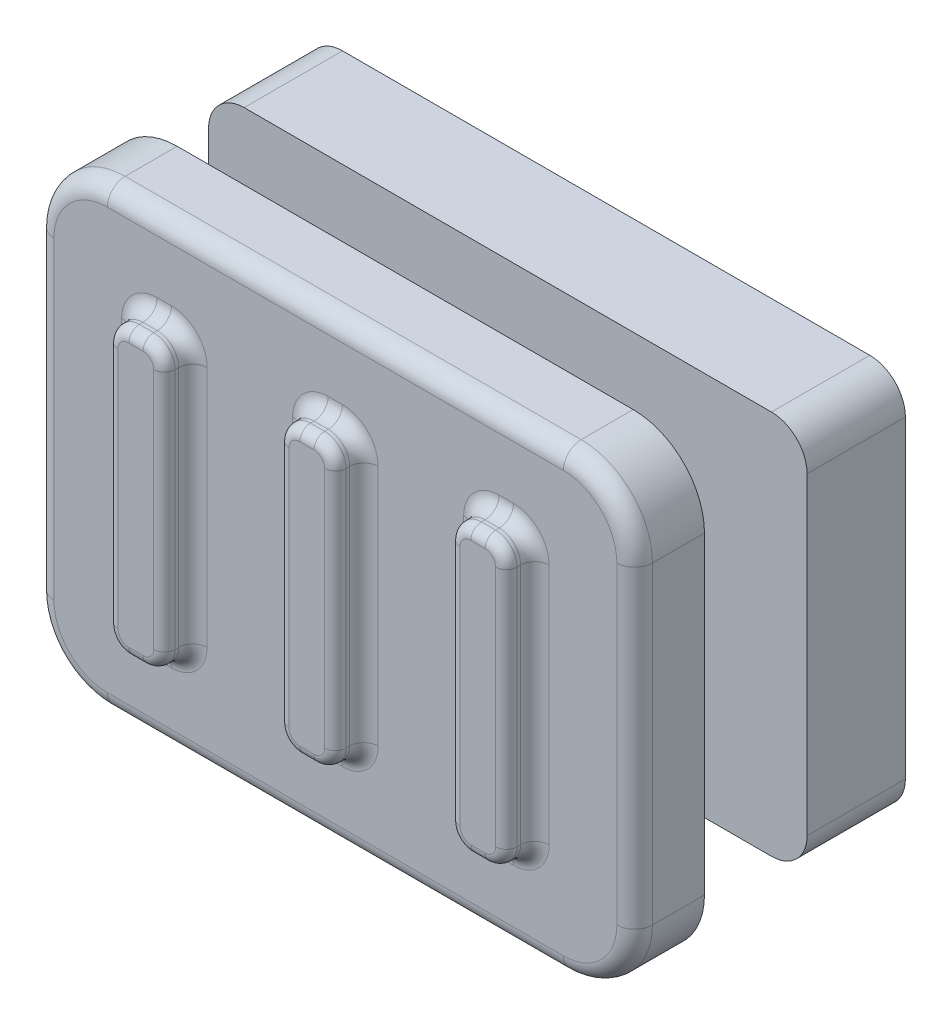
from build123d import *

# Parameters (mm, degrees)
SLIDER_STEM_DEPTH         = 4.2
CAPTIVE_FLANGE_START      = 1.2
CAPTIVE_FLANGE_DEPTH      = 1.38
THUMB_PAD_START           = 4.02
THUMB_PAD_DEPTH           = 0.98
SWITCH_PIN_SOCKET_START   = 2.3
SWITCH_PIN_SOCKET_DEPTH   = 2.4
PCB_EDGE_RELIEF_START     = 0.6
PCB_EDGE_RELIEF_PROFILE_W = 4
PCB_EDGE_RELIEF_PROFILE_H = 1.05
PCB_EDGE_RELIEF_DEPTH     = 0.7
STEM_SHOULDER_ROUND_R     = 0.2
THUMB_RIB_0_START         = 4.9
THUMB_RIB_0_DEPTH         = 0.5
THUMB_RIB_1_START         = 4.9
THUMB_RIB_1_DEPTH         = 0.5
THUMB_RIB_2_START         = 4.9
THUMB_RIB_2_DEPTH         = 0.5
THUMB_RIB_ROOT_ROUND_R    = 0.2
THUMB_PAD_EDGE_ROUND_R    = 0.25
THUMB_RIB_CROWN_ROUND_R   = 0.15


with BuildPart() as part:
    # Slider_stem_profile → Slider_stem (new body)
    with BuildSketch(Plane.XY):
        with BuildLine():
            Line((-1.5, -1.5), (1.5, -1.5))
            ThreePointArc((1.5, -1.5), (1.782842712, -1.382842712), (1.9, -1.1))
            Line((1.9, -1.1), (1.9, 1.1))
            ThreePointArc((1.9, 1.1), (1.782842712, 1.382842712), (1.5, 1.5))
            Line((1.5, 1.5), (-1.5, 1.5))
            ThreePointArc((-1.5, 1.5), (-1.782842712, 1.382842712), (-1.9, 1.1))
            Line((-1.9, 1.1), (-1.9, -1.1))
            ThreePointArc((-1.9, -1.1), (-1.782842712, -1.382842712), (-1.5, -1.5))
        make_face()
    extrude(amount=SLIDER_STEM_DEPTH)

    # Captive_flange_profile → Captive_flange (add)
    with BuildSketch(Plane.XY.offset(CAPTIVE_FLANGE_START)):
        with BuildLine():
            Line((-3.7, -2.7), (3.7, -2.7))
            ThreePointArc((3.7, -2.7), (4.053553391, -2.553553391), (4.2, -2.2))
            Line((4.2, -2.2), (4.2, 2.2))
            ThreePointArc((4.2, 2.2), (4.053553391, 2.553553391), (3.7, 2.7))
            Line((3.7, 2.7), (-3.7, 2.7))
            ThreePointArc((-3.7, 2.7), (-4.053553391, 2.553553391), (-4.2, 2.2))
            Line((-4.2, 2.2), (-4.2, -2.2))
            ThreePointArc((-4.2, -2.2), (-4.053553391, -2.553553391), (-3.7, -2.7))
        make_face()
    extrude(amount=CAPTIVE_FLANGE_DEPTH)

    # Thumb_pad_profile → Thumb_pad (add)
    with BuildSketch(Plane.XY.offset(THUMB_PAD_START)):
        with BuildLine():
            Line((-3.2, -3.2), (3.2, -3.2))
            ThreePointArc((3.2, -3.2), (3.907106781, -2.907106781), (4.2, -2.2))
            Line((4.2, -2.2), (4.2, 2.2))
            ThreePointArc((4.2, 2.2), (3.907106781, 2.907106781), (3.2, 3.2))
            Line((3.2, 3.2), (-3.2, 3.2))
            ThreePointArc((-3.2, 3.2), (-3.907106781, 2.907106781), (-4.2, 2.2))
            Line((-4.2, 2.2), (-4.2, -2.2))
            ThreePointArc((-4.2, -2.2), (-3.907106781, -2.907106781), (-3.2, -3.2))
        make_face()
    extrude(amount=THUMB_PAD_DEPTH)

    # Switch_pin_socket_profile → Switch_pin_socket (cut)
    with BuildSketch(Plane.XY.offset(SWITCH_PIN_SOCKET_START)):
        with BuildLine():
            Line((-0.725, -0.6), (0.725, -0.6))
            ThreePointArc((0.725, -0.6), (0.795710678, -0.570710678), (0.825, -0.5))
            Line((0.825, -0.5), (0.825, 0.5))
            ThreePointArc((0.825, 0.5), (0.795710678, 0.570710678), (0.725, 0.6))
            Line((0.725, 0.6), (-0.725, 0.6))
            ThreePointArc((-0.725, 0.6), (-0.795710678, 0.570710678), (-0.825, 0.5))
            Line((-0.825, 0.5), (-0.825, -0.5))
            ThreePointArc((-0.825, -0.5), (-0.795710678, -0.570710678), (-0.725, -0.6))
        make_face()
    extrude(amount=-SWITCH_PIN_SOCKET_DEPTH, mode=Mode.SUBTRACT)

    # PCB_edge_relief_profile → PCB_edge_relief (cut)
    with BuildSketch(Plane.XY.offset(PCB_EDGE_RELIEF_START)):
        with Locations((0, 1.075)):
            Rectangle(PCB_EDGE_RELIEF_PROFILE_W, PCB_EDGE_RELIEF_PROFILE_H)
    extrude(amount=-PCB_EDGE_RELIEF_DEPTH, mode=Mode.SUBTRACT)

    # Stem_shoulder_round
    stem_shoulder_round_edges = [part.edges().sort_by_distance(p)[0] for p in [
        (-1.9, 0, 1.2),
        (-1.9, 0, 2.58),
        (-1.782842712, -1.382842712, 1.2),
        (0, -1.5, 1.2),
        (1.782842712, -1.382842712, 1.2),
        (1.9, 0, 1.2),
        (1.782842712, 1.382842712, 1.2),
        (0, 1.5, 1.2),
        (-1.782842712, 1.382842712, 1.2),
        (-1.782842712, -1.382842712, 2.58),
        (0, -1.5, 2.58),
        (1.782842712, -1.382842712, 2.58),
        (1.9, 0, 2.58),
        (1.782842712, 1.382842712, 2.58),
        (0, 1.5, 2.58),
        (-1.782842712, 1.382842712, 2.58),
        (-1.9, 0, 4.02),
        (-1.782842712, -1.382842712, 4.02),
        (0, -1.5, 4.02),
        (1.782842712, -1.382842712, 4.02),
        (1.9, 0, 4.02),
        (1.782842712, 1.382842712, 4.02),
        (0, 1.5, 4.02),
        (-1.782842712, 1.382842712, 4.02),
    ]]
    fillet(stem_shoulder_round_edges, radius=STEM_SHOULDER_ROUND_R)

    # Thumb_rib_0_profile → Thumb_rib_0 (add)
    with BuildSketch(Plane.XY.offset(THUMB_RIB_0_START)):
        with BuildLine():
            Line((-2.5, -2), (-2.3, -2))
            ThreePointArc((-2.3, -2), (-2.087867966, -1.912132034), (-2, -1.7))
            Line((-2, -1.7), (-2, 1.7))
            ThreePointArc((-2, 1.7), (-2.087867966, 1.912132034), (-2.3, 2))
            Line((-2.3, 2), (-2.5, 2))
            ThreePointArc((-2.5, 2), (-2.712132034, 1.912132034), (-2.8, 1.7))
            Line((-2.8, 1.7), (-2.8, -1.7))
            ThreePointArc((-2.8, -1.7), (-2.712132034, -1.912132034), (-2.5, -2))
        make_face()
    extrude(amount=THUMB_RIB_0_DEPTH)

    # Thumb_rib_1_profile → Thumb_rib_1 (add)
    with BuildSketch(Plane.XY.offset(THUMB_RIB_1_START)):
        with BuildLine():
            Line((-0.1, -2), (0.1, -2))
            ThreePointArc((0.1, -2), (0.312132034, -1.912132034), (0.4, -1.7))
            Line((0.4, -1.7), (0.4, 1.7))
            ThreePointArc((0.4, 1.7), (0.312132034, 1.912132034), (0.1, 2))
            Line((0.1, 2), (-0.1, 2))
            ThreePointArc((-0.1, 2), (-0.312132034, 1.912132034), (-0.4, 1.7))
            Line((-0.4, 1.7), (-0.4, -1.7))
            ThreePointArc((-0.4, -1.7), (-0.312132034, -1.912132034), (-0.1, -2))
        make_face()
    extrude(amount=THUMB_RIB_1_DEPTH)

    # Thumb_rib_2_profile → Thumb_rib_2 (add)
    with BuildSketch(Plane.XY.offset(THUMB_RIB_2_START)):
        with BuildLine():
            Line((2.3, -2), (2.5, -2))
            ThreePointArc((2.5, -2), (2.712132034, -1.912132034), (2.8, -1.7))
            Line((2.8, -1.7), (2.8, 1.7))
            ThreePointArc((2.8, 1.7), (2.712132034, 1.912132034), (2.5, 2))
            Line((2.5, 2), (2.3, 2))
            ThreePointArc((2.3, 2), (2.087867966, 1.912132034), (2, 1.7))
            Line((2, 1.7), (2, -1.7))
            ThreePointArc((2, -1.7), (2.087867966, -1.912132034), (2.3, -2))
        make_face()
    extrude(amount=THUMB_RIB_2_DEPTH)

    # Thumb_rib_root_round
    thumb_rib_root_round_edges = [part.edges().sort_by_distance(p)[0] for p in [
        (-2.8, 0, 5),
        (-2.712132034, 1.912132034, 5),
        (-2.4, 2, 5),
        (-2.087867966, 1.912132034, 5),
        (-2, 0, 5),
        (-2.087867966, -1.912132034, 5),
        (-2.4, -2, 5),
        (-2.712132034, -1.912132034, 5),
        (-0.4, 0, 5),
        (-0.312132034, 1.912132034, 5),
        (0, 2, 5),
        (0.312132034, 1.912132034, 5),
        (0.4, 0, 5),
        (0.312132034, -1.912132034, 5),
        (0, -2, 5),
        (-0.312132034, -1.912132034, 5),
        (2, 0, 5),
        (2.087867966, 1.912132034, 5),
        (2.4, 2, 5),
        (2.712132034, 1.912132034, 5),
        (2.8, 0, 5),
        (2.712132034, -1.912132034, 5),
        (2.4, -2, 5),
        (2.087867966, -1.912132034, 5),
    ]]
    fillet(thumb_rib_root_round_edges, radius=THUMB_RIB_ROOT_ROUND_R)

    # Thumb_pad_edge_round
    thumb_pad_edge_round_edges = [part.edges().sort_by_distance(p)[0] for p in [
        (-3.907106781, -2.907106781, 5),
        (0, -3.2, 5),
        (3.907106781, -2.907106781, 5),
        (4.2, 0, 5),
        (3.907106781, 2.907106781, 5),
        (0, 3.2, 5),
        (-3.907106781, 2.907106781, 5),
        (-4.2, 0, 5),
    ]]
    fillet(thumb_pad_edge_round_edges, radius=THUMB_PAD_EDGE_ROUND_R)

    # Thumb_rib_crown_round
    thumb_rib_crown_round_edges = [part.edges().sort_by_distance(p)[0] for p in [
        (-2.712132034, -1.912132034, 5.4),
        (-2.4, -2, 5.4),
        (-2.087867966, -1.912132034, 5.4),
        (-2, 0, 5.4),
        (-2.087867966, 1.912132034, 5.4),
        (-2.4, 2, 5.4),
        (-2.712132034, 1.912132034, 5.4),
        (-2.8, 0, 5.4),
        (-0.312132034, -1.912132034, 5.4),
        (0, -2, 5.4),
        (0.312132034, -1.912132034, 5.4),
        (0.4, 0, 5.4),
        (0.312132034, 1.912132034, 5.4),
        (0, 2, 5.4),
        (-0.312132034, 1.912132034, 5.4),
        (-0.4, 0, 5.4),
        (2.087867966, -1.912132034, 5.4),
        (2.4, -2, 5.4),
        (2.712132034, -1.912132034, 5.4),
        (2.8, 0, 5.4),
        (2.712132034, 1.912132034, 5.4),
        (2.4, 2, 5.4),
        (2.087867966, 1.912132034, 5.4),
        (2, 0, 5.4),
    ]]
    fillet(thumb_rib_crown_round_edges, radius=THUMB_RIB_CROWN_ROUND_R)


solid = part.part
